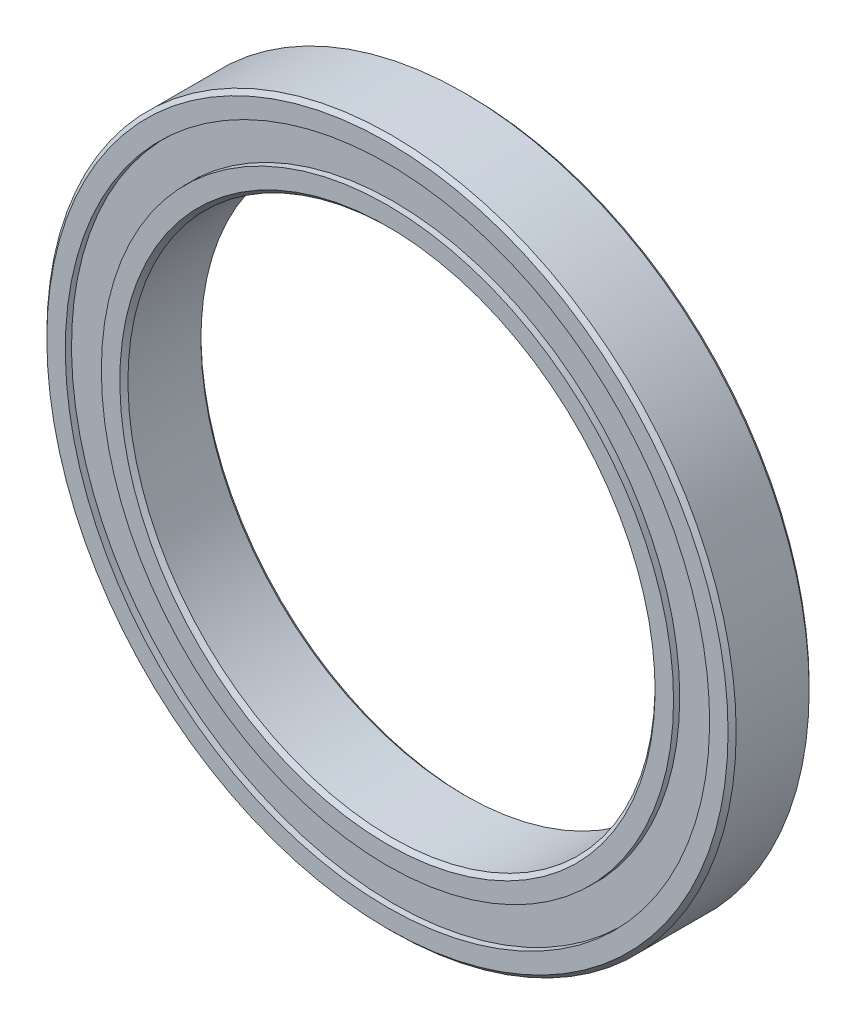
from build123d import *

# Parameters (mm, degrees)
SKETCH5_W         = 0.381
SKETCH5_H         = 4.393644444
CIRPATTERN1_COUNT = 23


with BuildPart() as part:
    # Sketch5 → Revolve1 (revolve)
    with BuildSketch(Plane(origin=(0, 0, 0), x_dir=(0, 0, -1), z_dir=(1, 0, 0)), mode=Mode.PRIVATE) as revolve1_sk:
        with BuildLine():
            Line((4.5, 42.5), (-4.5, 42.5))
            Line((-4.5, 42.5), (-5, 42))
            Line((-5, 42), (-5, 39.722222222))
            Line((-5, 39.722222222), (-2.222222222, 39.722222222))
            ThreePointArc((-2.222222222, 39.722222222), (0, 40.642696805), (2.222222222, 39.722222222))
            Line((2.222222222, 39.722222222), (5, 39.722222222))
            Line((5, 39.722222222), (5, 42))
            Line((5, 42), (4.5, 42.5))
        make_face()
        with Locations((4.071348403, 37.5)):
            Rectangle(SKETCH5_W, SKETCH5_H)
        with Locations((-4.071348403, 37.5)):
            Rectangle(SKETCH5_W, SKETCH5_H)
    revolve(revolve1_sk.sketch.rotate(Axis((0, 0, 5), (0, 0, -1)), 180), axis=Axis((0, 0, 5), (0, 0, -1)))


with BuildPart() as body_2:
    # Sketch3 → Revolve3 (revolve)
    with BuildSketch(Plane(origin=(0, 0, 0), x_dir=(0, 0, -1), z_dir=(1, 0, 0)), mode=Mode.PRIVATE) as revolve3_sk:
        with BuildLine():
            Line((-5, 35.277777778), (-2.222222222, 35.277777778))
            ThreePointArc((-2.222222222, 35.277777778), (0, 34.357303195), (2.222222222, 35.277777778))
            Line((2.222222222, 35.277777778), (5, 35.277777778))
            Line((5, 35.277777778), (5, 33))
            Line((5, 33), (4.5, 32.5))
            Line((4.5, 32.5), (-4.5, 32.5))
            Line((-4.5, 32.5), (-5, 33))
            Line((-5, 33), (-5, 35.277777778))
        make_face()
    revolve(revolve3_sk.sketch.rotate(Axis((0, 0, 5), (0, 0, -1)), 180), axis=Axis((0, 0, 5), (0, 0, -1)))


with BuildPart() as body_3:
    # Sketch4 → Revolve4 (revolve)
    with BuildSketch(Plane(origin=(0, 0, 0), x_dir=(0, 0, -1), z_dir=(1, 0, 0))):
        with BuildLine():
            Line((-3.142696805, 37.5), (3.142696805, 37.5))
            ThreePointArc((3.142696805, 37.5), (0, 40.642696805), (-3.142696805, 37.5))
        make_face()
    revolve(axis=Axis((0, 37.5, 3.142696805), (0, 0, -1)))


with BuildPart() as cirpattern1_1:
    # CirPattern1: pattern copy
    add(body_3.part.rotate(Axis((0, 0, 0), (0, 0, 1)), 1 * 360 / CIRPATTERN1_COUNT))


with BuildPart() as cirpattern1_2:
    # CirPattern1: pattern copy
    add(body_3.part.rotate(Axis((0, 0, 0), (0, 0, 1)), 2 * 360 / CIRPATTERN1_COUNT))


with BuildPart() as cirpattern1_3:
    # CirPattern1: pattern copy
    add(body_3.part.rotate(Axis((0, 0, 0), (0, 0, 1)), 3 * 360 / CIRPATTERN1_COUNT))


with BuildPart() as cirpattern1_4:
    # CirPattern1: pattern copy
    add(body_3.part.rotate(Axis((0, 0, 0), (0, 0, 1)), 4 * 360 / CIRPATTERN1_COUNT))


with BuildPart() as cirpattern1_5:
    # CirPattern1: pattern copy
    add(body_3.part.rotate(Axis((0, 0, 0), (0, 0, 1)), 5 * 360 / CIRPATTERN1_COUNT))


with BuildPart() as cirpattern1_6:
    # CirPattern1: pattern copy
    add(body_3.part.rotate(Axis((0, 0, 0), (0, 0, 1)), 6 * 360 / CIRPATTERN1_COUNT))


with BuildPart() as cirpattern1_7:
    # CirPattern1: pattern copy
    add(body_3.part.rotate(Axis((0, 0, 0), (0, 0, 1)), 7 * 360 / CIRPATTERN1_COUNT))


with BuildPart() as cirpattern1_8:
    # CirPattern1: pattern copy
    add(body_3.part.rotate(Axis((0, 0, 0), (0, 0, 1)), 8 * 360 / CIRPATTERN1_COUNT))


with BuildPart() as cirpattern1_9:
    # CirPattern1: pattern copy
    add(body_3.part.rotate(Axis((0, 0, 0), (0, 0, 1)), 9 * 360 / CIRPATTERN1_COUNT))


with BuildPart() as cirpattern1_10:
    # CirPattern1: pattern copy
    add(body_3.part.rotate(Axis((0, 0, 0), (0, 0, 1)), 10 * 360 / CIRPATTERN1_COUNT))


with BuildPart() as cirpattern1_11:
    # CirPattern1: pattern copy
    add(body_3.part.rotate(Axis((0, 0, 0), (0, 0, 1)), 11 * 360 / CIRPATTERN1_COUNT))


with BuildPart() as cirpattern1_12:
    # CirPattern1: pattern copy
    add(body_3.part.rotate(Axis((0, 0, 0), (0, 0, 1)), 12 * 360 / CIRPATTERN1_COUNT))


with BuildPart() as cirpattern1_13:
    # CirPattern1: pattern copy
    add(body_3.part.rotate(Axis((0, 0, 0), (0, 0, 1)), 13 * 360 / CIRPATTERN1_COUNT))


with BuildPart() as cirpattern1_14:
    # CirPattern1: pattern copy
    add(body_3.part.rotate(Axis((0, 0, 0), (0, 0, 1)), 14 * 360 / CIRPATTERN1_COUNT))


with BuildPart() as cirpattern1_15:
    # CirPattern1: pattern copy
    add(body_3.part.rotate(Axis((0, 0, 0), (0, 0, 1)), 15 * 360 / CIRPATTERN1_COUNT))


with BuildPart() as cirpattern1_16:
    # CirPattern1: pattern copy
    add(body_3.part.rotate(Axis((0, 0, 0), (0, 0, 1)), 16 * 360 / CIRPATTERN1_COUNT))


with BuildPart() as cirpattern1_17:
    # CirPattern1: pattern copy
    add(body_3.part.rotate(Axis((0, 0, 0), (0, 0, 1)), 17 * 360 / CIRPATTERN1_COUNT))


with BuildPart() as cirpattern1_18:
    # CirPattern1: pattern copy
    add(body_3.part.rotate(Axis((0, 0, 0), (0, 0, 1)), 18 * 360 / CIRPATTERN1_COUNT))


with BuildPart() as cirpattern1_19:
    # CirPattern1: pattern copy
    add(body_3.part.rotate(Axis((0, 0, 0), (0, 0, 1)), 19 * 360 / CIRPATTERN1_COUNT))


with BuildPart() as cirpattern1_20:
    # CirPattern1: pattern copy
    add(body_3.part.rotate(Axis((0, 0, 0), (0, 0, 1)), 20 * 360 / CIRPATTERN1_COUNT))


with BuildPart() as cirpattern1_21:
    # CirPattern1: pattern copy
    add(body_3.part.rotate(Axis((0, 0, 0), (0, 0, 1)), 21 * 360 / CIRPATTERN1_COUNT))


with BuildPart() as cirpattern1_22:
    # CirPattern1: pattern copy
    add(body_3.part.rotate(Axis((0, 0, 0), (0, 0, 1)), 22 * 360 / CIRPATTERN1_COUNT))


solid = Compound([part.part, body_2.part, body_3.part, cirpattern1_1.part, cirpattern1_2.part, cirpattern1_3.part, cirpattern1_4.part, cirpattern1_5.part, cirpattern1_6.part, cirpattern1_7.part, cirpattern1_8.part, cirpattern1_9.part, cirpattern1_10.part, cirpattern1_11.part, cirpattern1_12.part, cirpattern1_13.part, cirpattern1_14.part, cirpattern1_15.part, cirpattern1_16.part, cirpattern1_17.part, cirpattern1_18.part, cirpattern1_19.part, cirpattern1_20.part, cirpattern1_21.part, cirpattern1_22.part])
